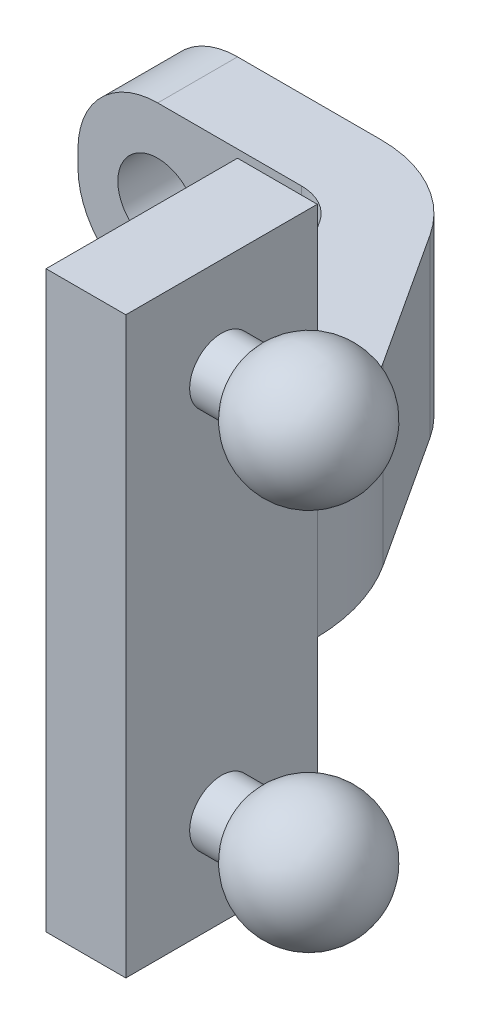
from build123d import *

# Parameters (mm, degrees)
EXTRUDE_1_DEPTH     = 2.75
SKETCH_2_R          = 1.25
CUT_EXTRUDE_1_DEPTH = 10
FILLET_2_R          = 2.5
EXTRUDE_2_REACH     = 21.1
SKETCH_4_W          = 6
SKETCH_4_H          = 18
SKETCH_5_R          = 1
EXTRUDE_3_DEPTH     = 1


with BuildPart() as part:
    # 草图1 → 凸台-拉伸1 (new, symmetric)
    with BuildSketch(Plane(origin=(0, 0, 0), x_dir=(1, 0, 0), z_dir=(0, 1, 0))):
        with BuildLine():
            Line((0, 0), (7, 0))
            ThreePointArc((7, 0), (8.907645559, -0.484194485), (10.353455389, -1.819555789))
            Line((10.353455389, -1.819555789), (13.08620622, -6.022441585))
            ThreePointArc((13.08620622, -6.022441585), (13.76673936, -7.496994372), (14, -9.104172255))
            Line((14, -9.104172255), (14, -15))
            Line((14, -15), (11.5, -15))
            Line((11.5, -15), (11.5, -9.104172255))
            ThreePointArc((11.5, -9.104172255), (11.369889965, -8.207707378), (10.990296602, -7.385219216))
            Line((10.990296602, -7.385219216), (8.257545771, -3.182333421))
            ThreePointArc((8.257545771, -3.182333421), (7.715367085, -2.681572932), (7, -2.5))
            Line((7, -2.5), (0, -2.5))
            Line((0, -2.5), (0, 0))
        make_face()
    extrude(amount=EXTRUDE_1_DEPTH, both=True)

    # 草图2 → 切除-拉伸1 (cut)
    with BuildSketch(Plane(origin=(0, 0, 0), x_dir=(-1, 0, 0), z_dir=(0, 0, -1))):
        with Locations((-2.5, 0)):
            Circle(SKETCH_2_R)
    extrude(amount=-CUT_EXTRUDE_1_DEPTH, mode=Mode.SUBTRACT)

    # 圆角2
    fillet_2_edges = [part.edges().sort_by_distance(p)[0] for p in [
        (0, -2.75, 1.25),
        (0, 2.75, 1.25),
    ]]
    fillet(fillet_2_edges, radius=FILLET_2_R)

    # 凸台-拉伸2: up to this face of the body (flat: up to its plane)
    extrude_2_end = Plane(part.part.faces().sort_by_distance((14, 0, 12.052086128))[0])
    # 草图4 → 凸台-拉伸2 (add, up to the picked face)
    with BuildSketch(Plane.ZY.offset(-11.5), mode=Mode.PRIVATE) as extrude_2_sk1:
        with Locations((12, 0)):
            Rectangle(SKETCH_4_W, SKETCH_4_H)
    extrude_2_tool1 = split(extrude(extrude_2_sk1.sketch, amount=-EXTRUDE_2_REACH, mode=Mode.PRIVATE), bisect_by=extrude_2_end, keep=Keep.BOTH, mode=Mode.PRIVATE)
    add(extrude_2_tool1.solids().sort_by(Axis((11.5, 0, 12), (1, 0, 0)))[0])

    # 草图5 → 凸台-拉伸3 (add)
    with BuildSketch(Plane(origin=(14, 0, 0), x_dir=(0, 0, -1), z_dir=(1, 0, 0))):
        with Locations(Location((-12, 6, 0), (0, 0, 180))):
            Circle(SKETCH_5_R)
    extrude_3 = extrude(amount=EXTRUDE_3_DEPTH)

    # 草图6 → 旋转1 (revolve)
    with BuildSketch(Plane(origin=(0, 0, 12), x_dir=(-1, 0, 0), z_dir=(0, 0, -1))):
        with BuildLine():
            Line((-15, 6), (-18.732050808, 6))
            ThreePointArc((-18.732050808, 6), (-17.249688898, 7.931851653), (-15, 7))
            Line((-15, 7), (-15, 6))
        make_face()
    revolve_1 = revolve(axis=Axis((15, 6, 12), (1, 0, 0)))

    # 镜向1: 凸台-拉伸3, 旋转1 across plane
    add(extrude_3.mirror(Plane.ZX))
    add(revolve_1.mirror(Plane.ZX))


solid = part.part
